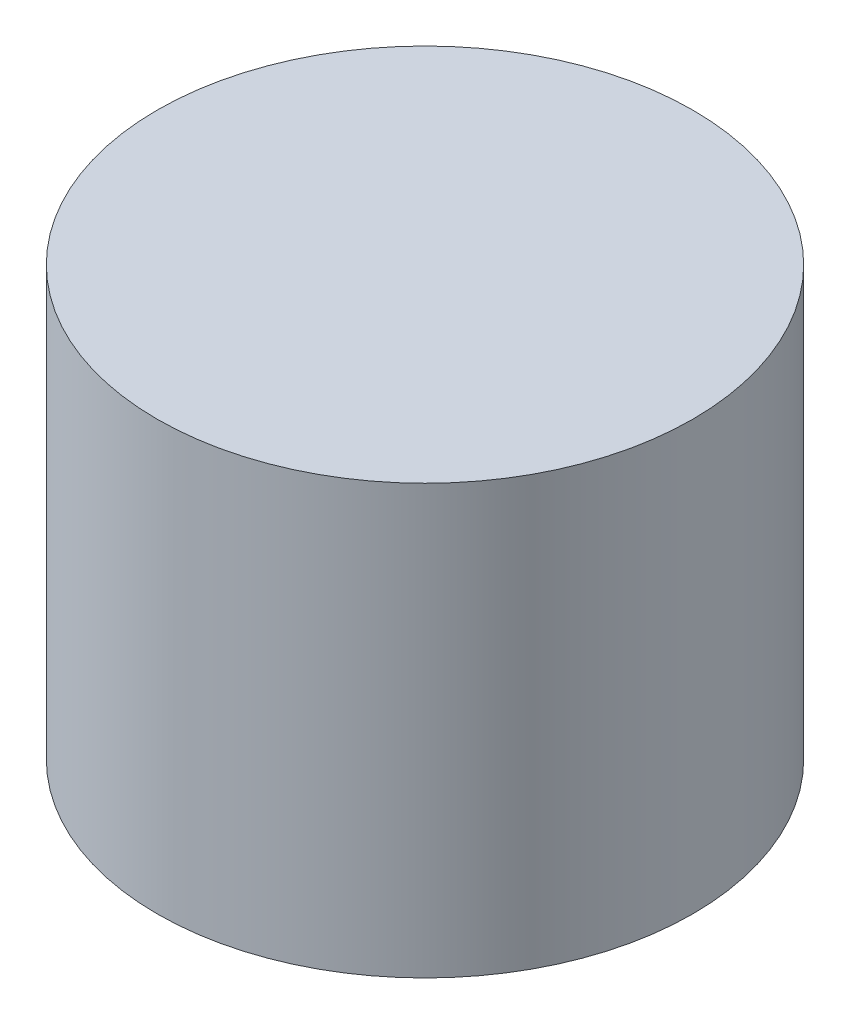
from build123d import *

# Parameters (mm, degrees)
SHOCK_CORD_BUNDLE_PROFILE_R  = 63.5
SHOCK_CORD_BUNDLE_BODY_DEPTH = 101.6


with BuildPart() as part:
    # Shock Cord Bundle Profile → Shock Cord Bundle Body (new body)
    with BuildSketch(Plane(origin=(0, 0, 0), x_dir=(1, 0, 0), z_dir=(0, 1, 0))):
        with Locations(Location((0, 0, 0), (0, 0, 270))):
            Circle(SHOCK_CORD_BUNDLE_PROFILE_R)
    extrude(amount=SHOCK_CORD_BUNDLE_BODY_DEPTH)


solid = part.part
